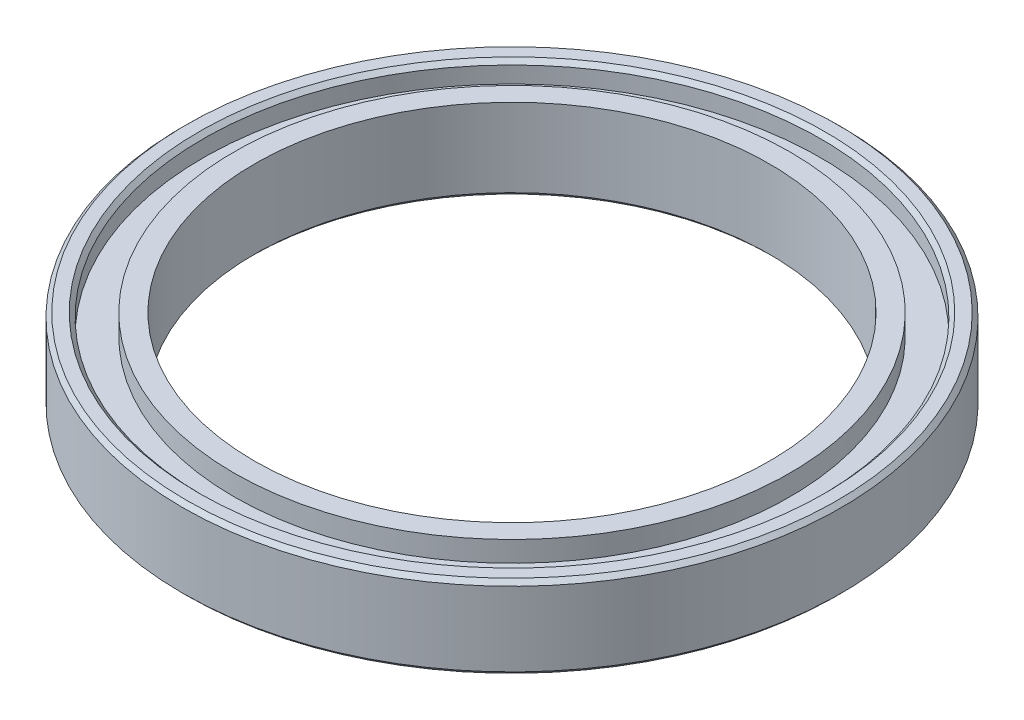
from build123d import *

# Parameters (mm, degrees)
SKETCH1_R           = 16
SKETCH1_R_2         = 12.5
BOSS_EXTRUDE1_DEPTH = 4
SKETCH2_R           = 15
SKETCH2_R_2         = 13.5
CUT_EXTRUDE1_DEPTH  = 1
CUT_EXTRUDE2_START  = -1
SKETCH3_R           = 15
SKETCH3_R_2         = 13.5
CUT_EXTRUDE2_DEPTH  = 1
CHAMFER1_SIZE       = 0.2


with BuildPart() as part:
    # Sketch1 → Boss-Extrude1 (new body)
    with BuildSketch(Plane(origin=(0, 0, 0), x_dir=(1, 0, 0), z_dir=(0, 1, 0))):
        with Locations(Location((0, 0, 0), (0, 0, 270))):
            Circle(SKETCH1_R)
        with Locations(Location((0, 0, 0), (0, 0, 270))):
            Circle(SKETCH1_R_2, mode=Mode.SUBTRACT)
    extrude(amount=BOSS_EXTRUDE1_DEPTH)

    # Sketch2 → Cut-Extrude1 (cut)
    with BuildSketch(Plane(origin=(0, 4, 0), x_dir=(1, 0, 0), z_dir=(0, 1, 0))):
        with Locations(Location((0, 0, 0), (0, 0, 270))):
            Circle(SKETCH2_R)
        with Locations(Location((0, 0, 0), (0, 0, 270))):
            Circle(SKETCH2_R_2, mode=Mode.SUBTRACT)
    extrude(amount=-CUT_EXTRUDE1_DEPTH, mode=Mode.SUBTRACT)

    # Sketch3 → Cut-Extrude2 (cut)
    with BuildSketch(Plane.XZ.offset(CUT_EXTRUDE2_START)):
        with Locations(Location((0, 0, 0), (0, 0, 90))):
            Circle(SKETCH3_R)
        with Locations(Location((0, 0, 0), (0, 0, 90))):
            Circle(SKETCH3_R_2, mode=Mode.SUBTRACT)
    extrude(amount=CUT_EXTRUDE2_DEPTH, mode=Mode.SUBTRACT)

    # Chamfer1
    chamfer1_edges = [part.edges().sort_by_distance(p)[0] for p in [
        (0, 4, -15),
        (0, 0, -16),
        (0, 0, -15),
        (0, 0, -13.5),
        (0, 4, -16),
        (0, 0, -12.5),
    ]]
    chamfer(chamfer1_edges, length=CHAMFER1_SIZE)


solid = part.part
